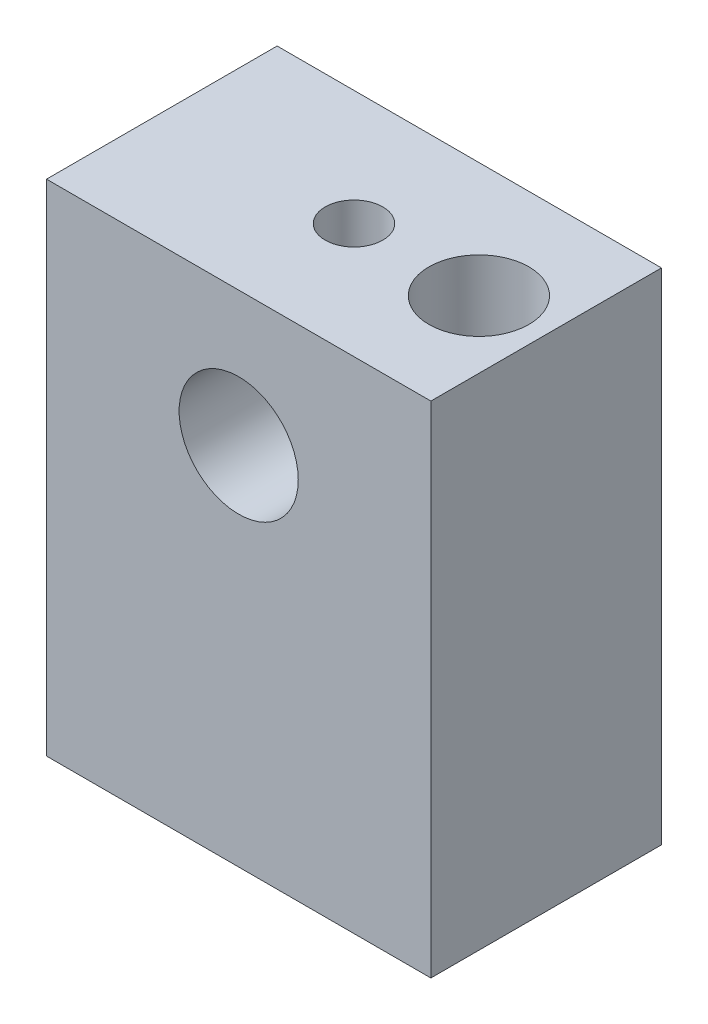
from build123d import *

# Parameters (mm, degrees)
SKETCH1_W           = 20
SKETCH1_H           = 26
BOSS_EXTRUDE1_DEPTH = 12
SKETCH2_R           = 3.1
CUT_EXTRUDE1_DEPTH  = 40
SKETCH3_R           = 2.6
SKETCH3_R_2         = 1.5
CUT_EXTRUDE2_DEPTH  = 40


with BuildPart() as part:
    # Sketch1 → Boss-Extrude1 (new body)
    with BuildSketch(Plane.XY):
        with Locations((0, 13)):
            Rectangle(SKETCH1_W, SKETCH1_H)
    extrude(amount=BOSS_EXTRUDE1_DEPTH)

    # Sketch2 → Cut-Extrude1 (cut, symmetric)
    with BuildSketch(Plane.XY):
        with Locations((0, 19)):
            Circle(SKETCH2_R)
    extrude(amount=CUT_EXTRUDE1_DEPTH, both=True, mode=Mode.SUBTRACT)

    # Sketch3 → Cut-Extrude2 (cut, symmetric)
    with BuildSketch(Plane(origin=(0, 0, 0), x_dir=(1, 0, 0), z_dir=(0, 1, 0))):
        with Locations((6.5, -6)):
            Circle(SKETCH3_R)
        with Locations((0, -6)):
            Circle(SKETCH3_R_2)
    extrude(amount=CUT_EXTRUDE2_DEPTH, both=True, mode=Mode.SUBTRACT)


solid = part.part
